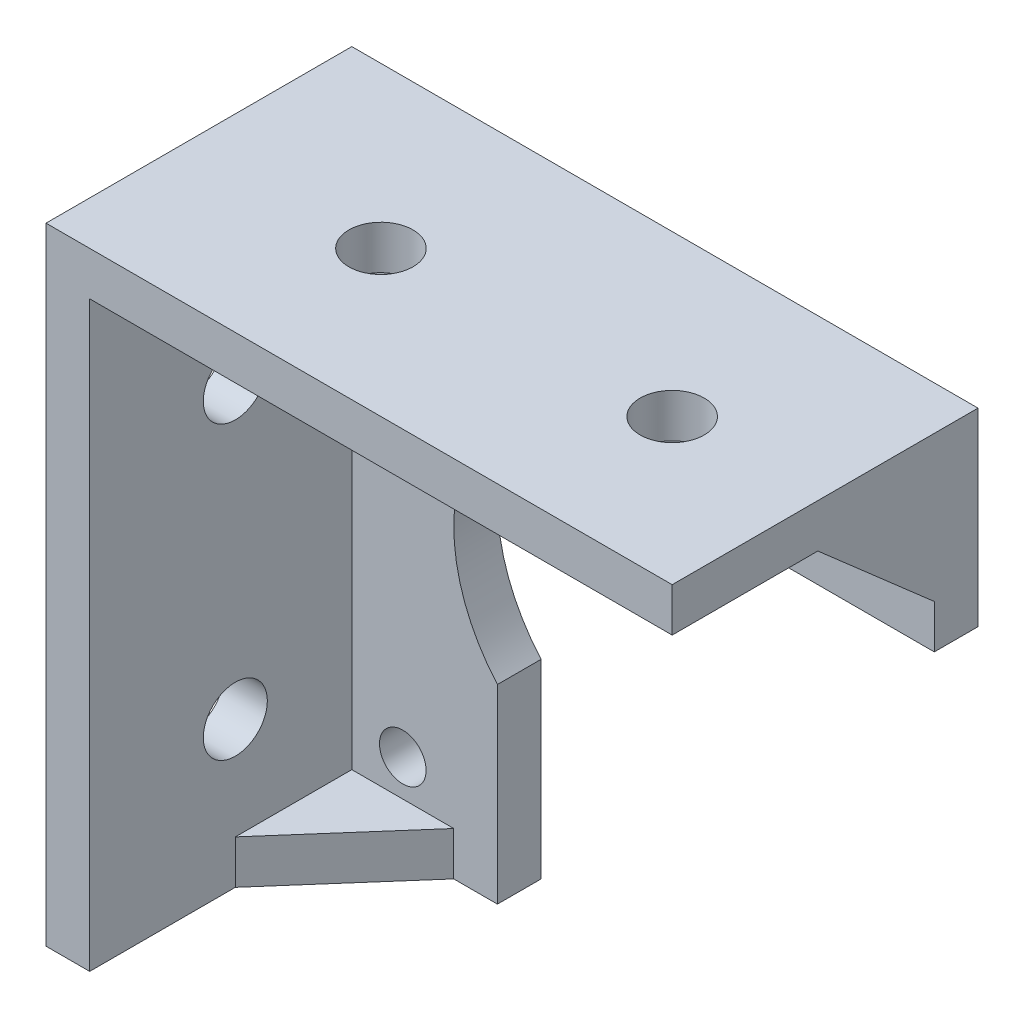
from build123d import *

# Parameters (mm, degrees)
BOSS_EXTRUDE1_DEPTH = 3
BOSS_EXTRUDE2_DEPTH = 18
SKETCH3_R           = 12
CUT_EXTRUDE1_DEPTH  = 64.419239983
SKETCH4_R           = 1.6
CUT_EXTRUDE2_DEPTH  = 64.419239983
BOSS_EXTRUDE3_DEPTH = 2
BOSS_EXTRUDE4_DEPTH = 3
SKETCH7_R           = 2.2
CUT_EXTRUDE3_DEPTH  = 63.369864518
SKETCH8_R           = 2.2
CUT_EXTRUDE4_DEPTH  = 63.369864518


with BuildPart() as part:
    # Sketch1 → Boss-Extrude1 (new body)
    with BuildSketch(Plane.XY):
        Polygon((0, -43), (0, 0), (43, 0), (43, -13), (19, -13), (13, -19), (13, -43), align=None)
    extrude(amount=BOSS_EXTRUDE1_DEPTH)

    # Sketch2 → Boss-Extrude2 (add)
    with BuildSketch(Plane.XY.offset(3)):
        Polygon((0, -43), (3, -43), (3, -3), (43, -3), (43, 0), (0, 0), align=None)
    extrude(amount=BOSS_EXTRUDE2_DEPTH)

    # Sketch3 → Cut-Extrude1 (cut, through all)
    with BuildSketch(Plane.XY.offset(3)):
        with Locations((22, -22)):
            Circle(SKETCH3_R)
    extrude(amount=-CUT_EXTRUDE1_DEPTH, mode=Mode.SUBTRACT)

    # Sketch4 → Cut-Extrude2 (cut, through all)
    with BuildSketch(Plane.XY.offset(3)):
        with Locations((6.5, -6.5)):
            Circle(SKETCH4_R)
        with Locations((37.5, -6.5)):
            Circle(SKETCH4_R)
        with Locations((6.5, -37.5)):
            Circle(SKETCH4_R)
    extrude(amount=-CUT_EXTRUDE2_DEPTH, mode=Mode.SUBTRACT)

    # Sketch5 → Boss-Extrude3 (add)
    with BuildSketch(Plane(origin=(43, 0, 0), x_dir=(0, 0, -1), z_dir=(1, 0, 0))):
        Polygon((-3, -10), (-11, -3), (-3, -3), align=None)
    extrude(amount=-BOSS_EXTRUDE3_DEPTH)

    # Sketch6 → Boss-Extrude4 (add)
    with BuildSketch(Plane.XZ.offset(43)):
        Polygon((3, 11), (10, 3), (3, 3), align=None)
    extrude(amount=-BOSS_EXTRUDE4_DEPTH)

    # Sketch7 → Cut-Extrude3 (cut, through all)
    with BuildSketch(Plane.XZ.offset(3)):
        with Locations(Location((13, 11, 0), (0, 0, 270))):
            Circle(SKETCH7_R)
        with Locations(Location((33, 11, 0), (0, 0, 270))):
            Circle(SKETCH7_R)
    extrude(amount=-CUT_EXTRUDE3_DEPTH, mode=Mode.SUBTRACT)

    # Sketch8 → Cut-Extrude4 (cut, through all)
    with BuildSketch(Plane(origin=(3, 0, 0), x_dir=(0, 0, -1), z_dir=(1, 0, 0))):
        with Locations((-11, -33)):
            Circle(SKETCH8_R)
        with Locations((-11, -13)):
            Circle(SKETCH8_R)
    extrude(amount=-CUT_EXTRUDE4_DEPTH, mode=Mode.SUBTRACT)


solid = part.part
